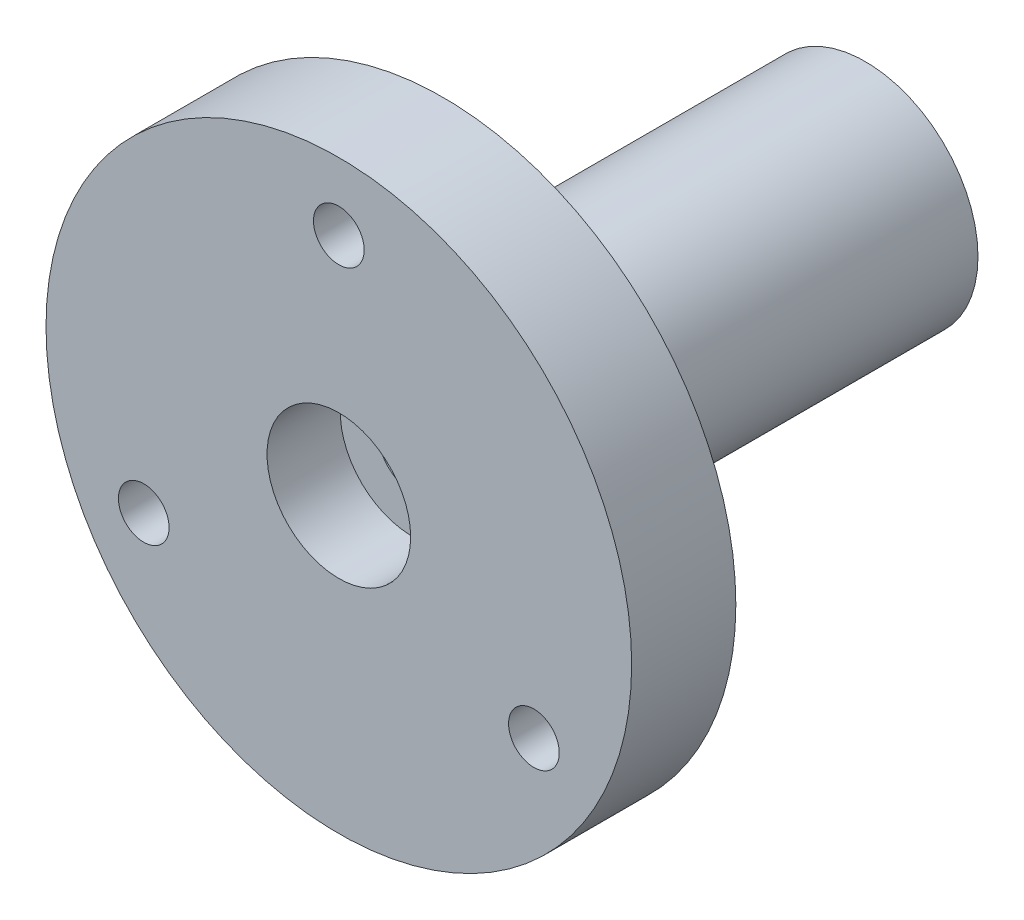
from build123d import *

# Parameters (mm, degrees)
SKETCH_1_R               = 10.4
EXTRUDE_1_DEPTH          = 3.7
SKETCH_2_R               = 0.9
CUT_EXTRUDE_1_DEPTH      = 16.166080575
SKETCH_2_3_R             = 1.5
CUT_EXTRUDE_2_DEPTH      = 1.5
PATTERN_CIRCULAR_1_COUNT = 3
SKETCH_3_R               = 1.2
CUT_EXTRUDE_3_DEPTH      = 16.166080575
SKETCH_4_R               = 2.55
CUT_EXTRUDE_4_DEPTH      = 2.6
EXTRUDE_START            = 15
SKETCH_5_R               = 4
SKETCH_5_R_2             = 1.2
EXTRUDE_2_DEPTH          = 15


with BuildPart() as part:
    # 草图1 → 凸台-拉伸1 (new body)
    with BuildSketch(Plane.XY):
        Circle(SKETCH_1_R)
    extrude(amount=EXTRUDE_1_DEPTH)

    # 草图2 → 切除-拉伸1 (cut, through all)
    with BuildSketch(Plane(origin=(0, 0, 0), x_dir=(-1, 0, 0), z_dir=(0, 0, -1))):
        with Locations((0, 8)):
            Circle(SKETCH_2_R)
    cut_extrude_1 = extrude(amount=-CUT_EXTRUDE_1_DEPTH, mode=Mode.SUBTRACT)

    # 草图2<3> → 切除-拉伸2 (cut)
    with BuildSketch(Plane(origin=(0, 0, 0), x_dir=(-1, 0, 0), z_dir=(0, 0, -1))):
        with Locations((0, 8)):
            Circle(SKETCH_2_3_R)
    cut_extrude_2 = extrude(amount=-CUT_EXTRUDE_2_DEPTH, mode=Mode.SUBTRACT)

    # 阵列(圆周)1: 切除-拉伸1, 切除-拉伸2 ×3 about axis
    pattern_circular_1_axis = Axis((0, 0, 3.7), (0, 0, -1))
    add([cut_extrude_1.rotate(pattern_circular_1_axis, i * 360 / PATTERN_CIRCULAR_1_COUNT) for i in range(1, PATTERN_CIRCULAR_1_COUNT)], mode=Mode.SUBTRACT)
    add([cut_extrude_2.rotate(pattern_circular_1_axis, i * 360 / PATTERN_CIRCULAR_1_COUNT) for i in range(1, PATTERN_CIRCULAR_1_COUNT)], mode=Mode.SUBTRACT)

    # 草图3 → 切除-拉伸3 (cut, through all)
    with BuildSketch(Plane(origin=(0, 0, 0), x_dir=(-1, 0, 0), z_dir=(0, 0, -1))):
        Circle(SKETCH_3_R)
    extrude(amount=-CUT_EXTRUDE_3_DEPTH, mode=Mode.SUBTRACT)

    # 草图4 → 切除-拉伸4 (cut)
    with BuildSketch(Plane.XY.offset(3.7)):
        Circle(SKETCH_4_R)
    extrude(amount=-CUT_EXTRUDE_4_DEPTH, mode=Mode.SUBTRACT)

    # 草图5 → 凸台-拉伸2 (add)
    with BuildSketch(Plane(origin=(0, 0, 0), x_dir=(-1, 0, 0), z_dir=(0, 0, -1)).offset(EXTRUDE_START)):
        Circle(SKETCH_5_R)
        Circle(SKETCH_5_R_2, mode=Mode.SUBTRACT)
    extrude(amount=-EXTRUDE_2_DEPTH)


solid = part.part
